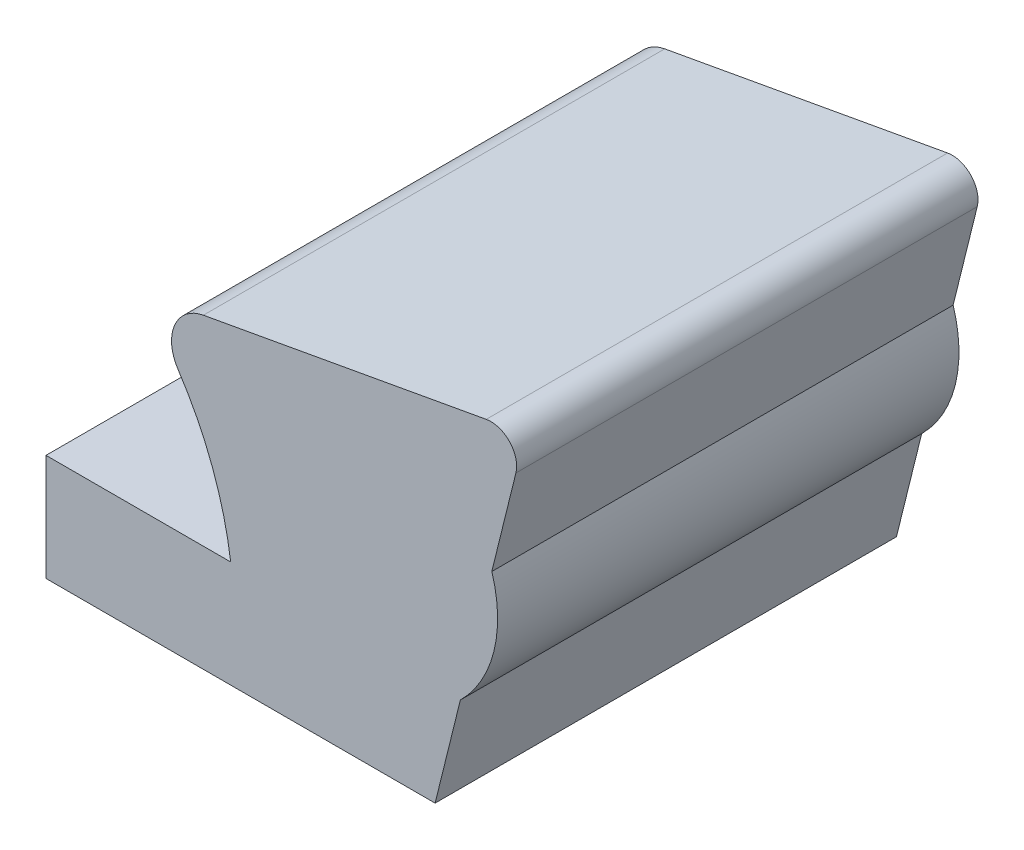
from build123d import *

# Parameters (mm, degrees)
EXTRUDE_1_DEPTH                = 50
SPLIT_BODIES_1_SURFACE_1_BACK  = 232.206
SPLIT_BODIES_1_SURFACE_1_DEPTH = 464.412
SPLIT_BODIES_1_SURFACE_2_BACK  = 232.206
SPLIT_BODIES_1_SURFACE_2_DEPTH = 464.412


with BuildPart() as part:
    # 草图2 → 凸台-拉伸1 (new, symmetric)
    with BuildSketch(Plane.XY):
        with BuildLine():
            Line((120.381757685, 62.513778912), (136.603924057, 62.513778912))
            Line((136.603924057, 62.513778912), (142.075022588, 84.611982407))
            ThreePointArc((142.075022588, 84.611982407), (149.356663913, 97.416787069), (148.890397999, 112.139827479))
            Line((148.890397999, 112.139827479), (154.115877694, 133.245956899))
            ThreePointArc((154.115877694, 133.245956899), (152.763547037, 138.423832473), (147.681959543, 140.102123925))
            Line((147.681959543, 140.102123925), (86.373837206, 128.997923897))
            ThreePointArc((86.373837206, 128.997923897), (80.146286191, 124.032461274), (80.863683371, 116.100024575))
            ThreePointArc((80.863683371, 116.100024575), (88.300101913, 101.512259026), (92.288223879, 85.631512581))
            Line((92.288223879, 85.631512581), (52.259104564, 85.631512581))
            Line((52.259104564, 85.631512581), (52.259104564, 37.347972633))
            Line((52.259104564, 37.347972633), (26.12059868, 28.530814049))
            Line((26.12059868, 28.530814049), (0, 28.530814049))
            Line((0, 28.530814049), (0, 0))
            Line((0, 0), (140.98, 0))
            Line((140.98, 0), (131.928221984, 26.834036233))
            Line((131.928221984, 26.834036233), (115.249995775, 26.834036233))
            Line((115.249995775, 26.834036233), (120.381757685, 62.513778912))
        make_face()
    extrude(amount=EXTRUDE_1_DEPTH, both=True)


with BuildPart() as body_2:
    # Split Bodies 1: the piece behind the surface
    add(part.part)
    # Split Bodies 1 surface: a surface, the sketch's curves swept straight by 464.412 mm
    with BuildLine(Plane.XY.offset(50).offset(-SPLIT_BODIES_1_SURFACE_1_BACK), mode=Mode.PRIVATE) as split_bodies_1_surface_1_path:
        Line((120.381757685, 62.513778912), (52.259104564, 62.513778912))
    split_bodies_1_surface_1 = Shell.extrude(split_bodies_1_surface_1_path.wire(), (0 * SPLIT_BODIES_1_SURFACE_1_DEPTH, 0 * SPLIT_BODIES_1_SURFACE_1_DEPTH, 1 * SPLIT_BODIES_1_SURFACE_1_DEPTH))
    split(bisect_by=split_bodies_1_surface_1, keep=Keep.BOTTOM)


with BuildPart() as part_1:
    add(part.part)

    # Split Bodies 1: split by a surface, the side it looks to stays
    # Split Bodies 1 surface: a surface, the sketch's curves swept straight by 464.412 mm
    with BuildLine(Plane.XY.offset(50).offset(-SPLIT_BODIES_1_SURFACE_2_BACK), mode=Mode.PRIVATE) as split_bodies_1_surface_2_path:
        Line((120.381757685, 62.513778912), (52.259104564, 62.513778912))
    split_bodies_1_surface_2 = Shell.extrude(split_bodies_1_surface_2_path.wire(), (0 * SPLIT_BODIES_1_SURFACE_2_DEPTH, 0 * SPLIT_BODIES_1_SURFACE_2_DEPTH, 1 * SPLIT_BODIES_1_SURFACE_2_DEPTH))
    split(bisect_by=split_bodies_1_surface_2, keep=Keep.TOP)


solid = body_2.part
